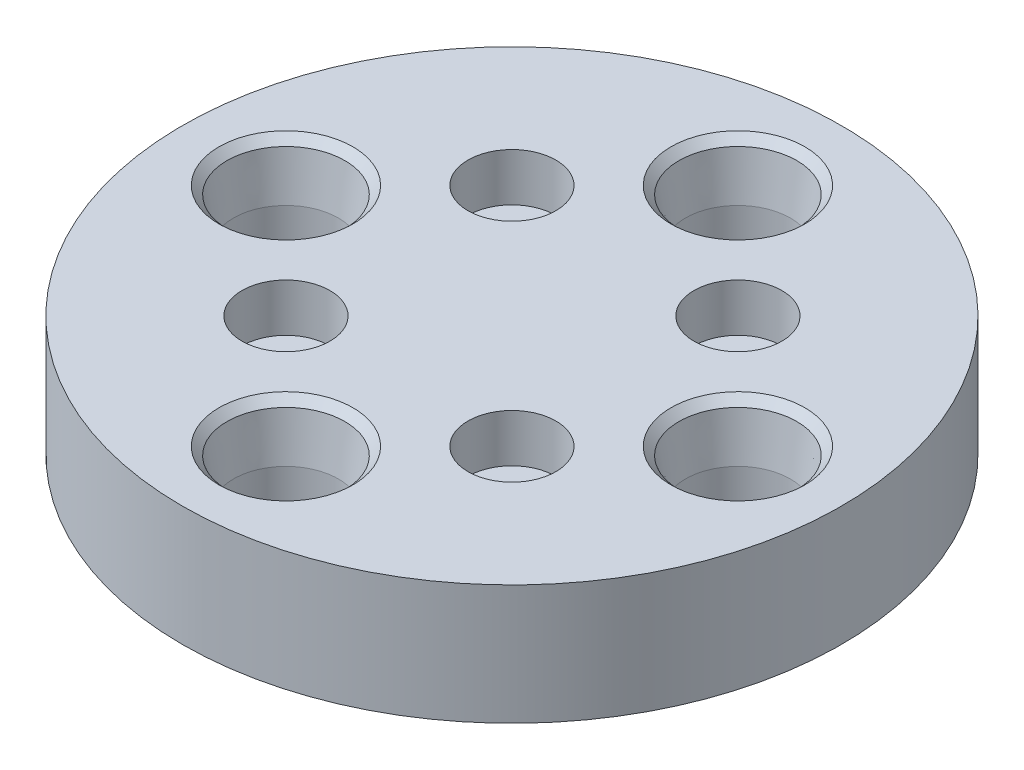
from build123d import *

# Parameters (mm, degrees)
SKETCH1_R                                           = 16.5
BOSS_EXTRUDE1_DEPTH                                 = 6
SKETCH25_R                                          = 10.25
BOSS_EXTRUDE2_DEPTH                                 = 2
SKETCH22_R                                          = 2.25
CUT_EXTRUDE1_DEPTH                                  = 46.38470183
CBORE_FOR_M2_HEX_SOCKET_HEAD_CAP_SCREW1_D           = 2.4
CBORE_FOR_M2_HEX_SOCKET_HEAD_CAP_SCREW1_CBORE_D     = 4.4
CBORE_FOR_M2_HEX_SOCKET_HEAD_CAP_SCREW1_CBORE_DEPTH = 2.4
CIRPATTERN1_COUNT                                   = 4
SKETCH26_R                                          = 4.5
CUT_EXTRUDE2_DEPTH                                  = 4.5


with BuildPart() as part:
    # Sketch1 → Boss-Extrude1 (new body)
    with BuildSketch(Plane(origin=(0, 0, 0), x_dir=(1, 0, 0), z_dir=(0, 1, 0))):
        with Locations(Location((0, 0, 0), (0, 0, 270))):
            Circle(SKETCH1_R)
    extrude(amount=-BOSS_EXTRUDE1_DEPTH)

    # Sketch25 → Boss-Extrude2 (add)
    with BuildSketch(Plane.XZ.offset(6)):
        with Locations(Location((0, 0, 0), (0, 0, 270))):
            Circle(SKETCH25_R)
    extrude(amount=BOSS_EXTRUDE2_DEPTH)

    # Sketch22 → Cut-Extrude1 (cut, through all)
    with BuildSketch(Plane(origin=(1.446175283, 0, 24.410951504), x_dir=(1, 0, 0), z_dir=(0, 1, 0))):
        with Locations(Location((-1.446175283, 35.724660003, 0), (0, 0, 270))):
            Circle(SKETCH22_R)
    cut_extrude1 = extrude(amount=-CUT_EXTRUDE1_DEPTH, mode=Mode.SUBTRACT)

    # Sketch3 → Cut-Revolve1 (revolve, cut)
    with BuildSketch(Plane(origin=(0, 0, -23.450692334), x_dir=(0, 0, -1), z_dir=(1, 0, 0))):
        Polygon((-12.136983835, 0), (-8.785226394, 0), (-9.185226394, -0.4), (-9.511983835, -2.725), (-9.511983835, -5.45), (-9.886983835, -5.825), (-12.136983835, -5.825), align=None)
    cut_revolve1 = revolve(axis=Axis((0, -5.825, -11.313708499), (0, 1, 0)), mode=Mode.SUBTRACT)

    # CBORE for M2 Hex Socket Head Cap Screw1 (through all)
    with Locations(Plane(origin=(0, 0, 0), x_dir=(1, 0, 0), z_dir=(0, 1, 0))):
        with Locations((5.656854249, 5.656854249)):
            cbore_for_m2_hex_socket_head_cap_screw1 = CounterBoreHole(CBORE_FOR_M2_HEX_SOCKET_HEAD_CAP_SCREW1_D / 2, CBORE_FOR_M2_HEX_SOCKET_HEAD_CAP_SCREW1_CBORE_D / 2, CBORE_FOR_M2_HEX_SOCKET_HEAD_CAP_SCREW1_CBORE_DEPTH)

    # CirPattern1: Cut-Extrude1, Cut-Revolve1, CBORE for M2 Hex Socket Head Cap Screw1 ×4 about axis
    cirpattern1_axis = Axis((0, 0, 0), (0, 1, 0))
    add([cut_extrude1.rotate(cirpattern1_axis, i * 360 / CIRPATTERN1_COUNT) for i in range(1, CIRPATTERN1_COUNT)], mode=Mode.SUBTRACT)
    add([cut_revolve1.rotate(cirpattern1_axis, i * 360 / CIRPATTERN1_COUNT) for i in range(1, CIRPATTERN1_COUNT)], mode=Mode.SUBTRACT)
    add([cbore_for_m2_hex_socket_head_cap_screw1.rotate(cirpattern1_axis, i * 360 / CIRPATTERN1_COUNT) for i in range(1, CIRPATTERN1_COUNT)], mode=Mode.SUBTRACT)

    # Sketch26 → Cut-Extrude2 (cut)
    with BuildSketch(Plane.XZ.offset(8)):
        with Locations(Location((0, 0, 0), (0, 0, 270))):
            Circle(SKETCH26_R)
    extrude(amount=-CUT_EXTRUDE2_DEPTH, mode=Mode.SUBTRACT)


solid = part.part
